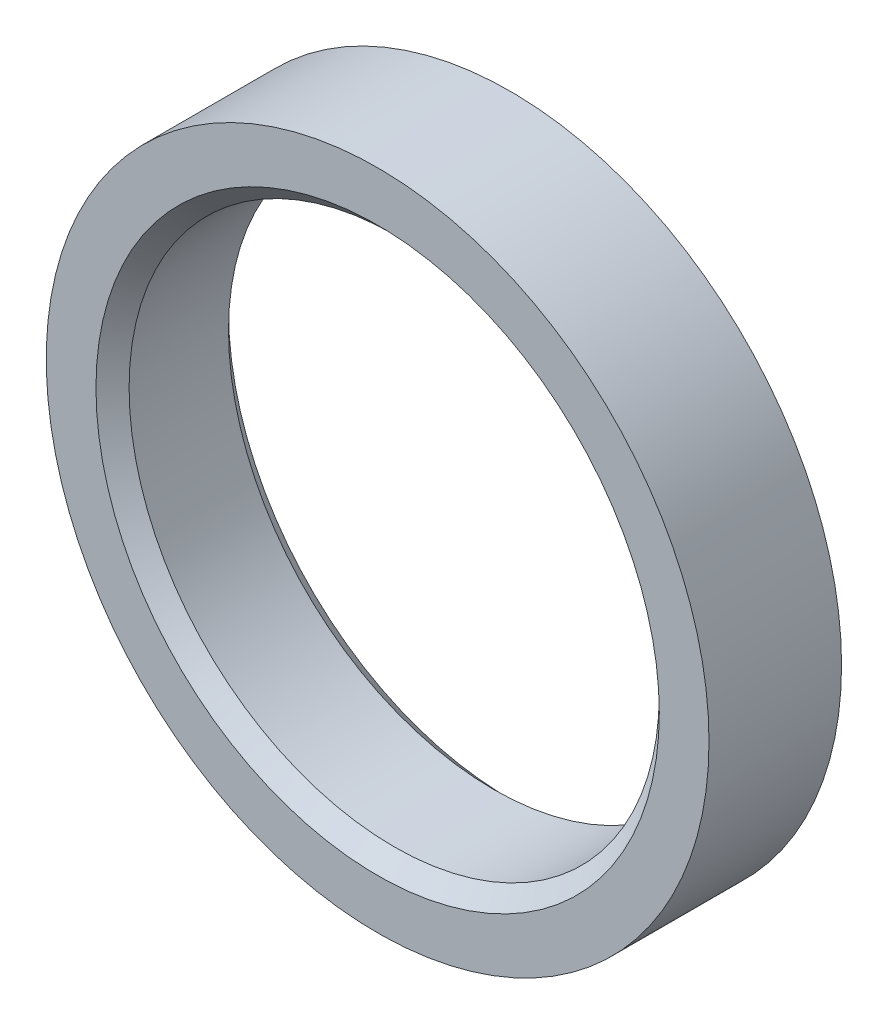
from build123d import *

# Parameters (mm, degrees)
SCHIZZO1_R                   = 20
SCHIZZO1_R_2                 = 16
ESTRUSIONE_ESTRUSIONE1_DEPTH = 8
SMUSSO2_SIZE                 = 1


with BuildPart() as part:
    # Schizzo1 → Estrusione-Estrusione1 (new body)
    with BuildSketch(Plane.XY):
        Circle(SCHIZZO1_R)
        Circle(SCHIZZO1_R_2, mode=Mode.SUBTRACT)
    extrude(amount=ESTRUSIONE_ESTRUSIONE1_DEPTH)

    # Smusso2
    smusso2_edges = [part.edges().sort_by_distance(p)[0] for p in [
        (-16, 0, 0),
        (-16, 0, 8),
    ]]
    chamfer(smusso2_edges, length=SMUSSO2_SIZE)


solid = part.part
